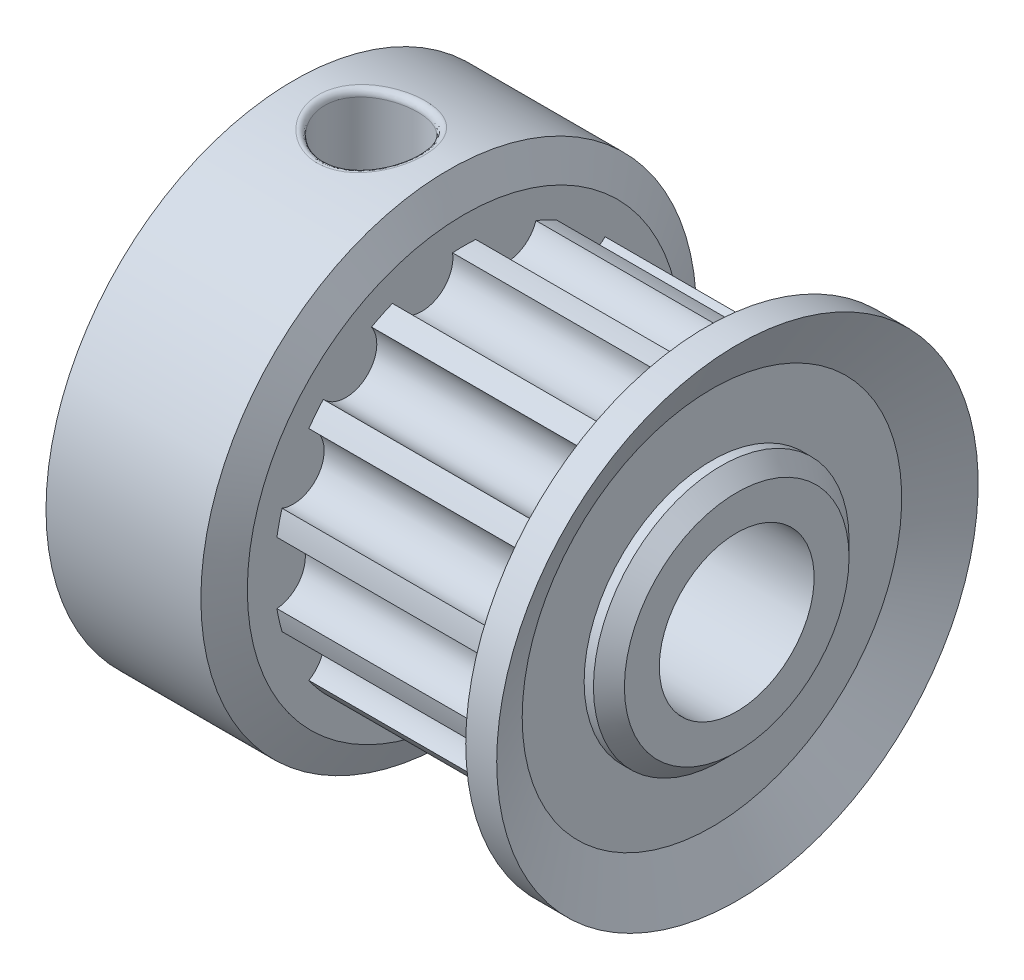
from build123d import *

# Parameters (mm, degrees)
IZIM2_R               = 2.5
KES_EKSTR_ZYON1_DEPTH = 19.647186502
IZIM3_R               = 1
KES_EKSTR_ZYON3_DEPTH = 7
IZIM4_R               = 1.5
KES_EKSTR_ZYON4_DEPTH = 27
RADYUS1_R             = 0.2


with BuildPart() as part:
    # Çizim1 → Döndür1 (revolve)
    with BuildSketch(Plane.XY, mode=Mode.PRIVATE) as d_nd_r1_sk:
        with BuildLine():
            Line((0, 7), (0, 3.9))
            ThreePointArc((0, 3.9), (0.029289322, 3.829289322), (0.1, 3.8))
            Line((0.1, 3.8), (0.3, 3.8))
            Line((0.3, 3.8), (0, 3.5))
            Line((0, 3.5), (0, 0))
            Line((0, 0), (14.8, 0))
            Line((14.8, 0), (14.8, 1.887324991))
            Line((14.8, 1.887324991), (14.8, 3.6263585))
            Line((14.8, 3.6263585), (14.3, 4.1263585))
            Line((14.3, 4.1263585), (14, 4.1263585))
            Line((14, 4.1263585), (14, 6.1263585))
            Line((14, 6.1263585), (14.822873016, 7.772104531))
            Line((14.822873016, 7.772104531), (13.822873016, 7.772104531))
            Line((13.822873016, 7.772104531), (13, 6.1263585))
            Line((13, 6.1263585), (6, 6.1263585))
            Line((6, 6.1263585), (6, 7))
            Line((6, 7), (5.5, 8))
            Line((5.5, 8), (0.5, 8))
            Line((0.5, 8), (0, 7))
        make_face()
    revolve(d_nd_r1_sk.sketch.rotate(Axis((0, 0, 0), (1, 0, 0)), 90), axis=Axis((0, 0, 0), (1, 0, 0)))

    # Çizim2 → Kes-Ekstrüzyon1 (cut, through all)
    with BuildSketch(Plane.ZY):
        Circle(IZIM2_R)
    extrude(amount=-KES_EKSTR_ZYON1_DEPTH, mode=Mode.SUBTRACT)

    # Çizim3 → Kes-Ekstrüzyon3 (cut)
    with BuildSketch(Plane(origin=(6, 0, 0), x_dir=(0, 0, -1), z_dir=(1, 0, 0))):
        with Locations((6.1263585, 0)):
            Circle(IZIM3_R)
        with Locations((5.519658282, -2.658127333)):
            Circle(IZIM3_R)
        with Locations((3.819722047, -4.789779948)):
            Circle(IZIM3_R)
        with Locations((1.363243015, -5.972757901)):
            Circle(IZIM3_R)
        with Locations((-1.363243015, -5.972757901)):
            Circle(IZIM3_R)
        with Locations((-3.819722047, -4.789779948)):
            Circle(IZIM3_R)
        with Locations((-5.519658282, -2.658127333)):
            Circle(IZIM3_R)
        with Locations((-6.1263585, 0)):
            Circle(IZIM3_R)
        with Locations((-5.519658282, 2.658127333)):
            Circle(IZIM3_R)
        with Locations((-3.819722047, 4.789779948)):
            Circle(IZIM3_R)
        with Locations((-1.363243015, 5.972757901)):
            Circle(IZIM3_R)
        with Locations((1.363243015, 5.972757901)):
            Circle(IZIM3_R)
        with Locations((3.819722047, 4.789779948)):
            Circle(IZIM3_R)
        with Locations((5.519658282, 2.658127333)):
            Circle(IZIM3_R)
    extrude(amount=KES_EKSTR_ZYON3_DEPTH, mode=Mode.SUBTRACT)

    # Çizim4 → Kes-Ekstrüzyon4 (cut)
    with BuildSketch(Plane(origin=(0, 0, 0), x_dir=(1, 0, 0), z_dir=(0, 1, 0))):
        with Locations(Location((3, 0, 0), (0, 0, 90))):
            Circle(IZIM4_R)
    extrude(amount=KES_EKSTR_ZYON4_DEPTH, mode=Mode.SUBTRACT)

    # Radyus1
    radyus1_edges = [part.edges().sort_by_distance(p)[0] for p in [
        (2.999999997, 7.858116824, 1.500000004),
        (3, 2, 1.5),
    ]]
    fillet(radyus1_edges, radius=RADYUS1_R)


solid = part.part
